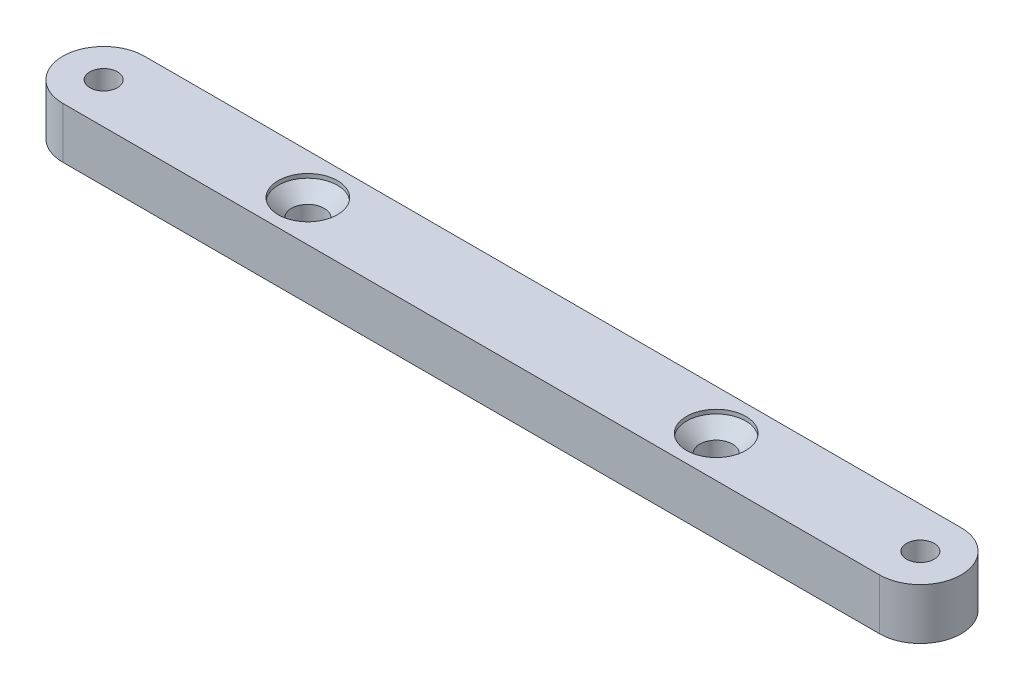
from build123d import *

# Parameters (mm, degrees)
ESQUISSE1_R        = 1.35
BOSS_EXTRU_1_DEPTH = 5


with BuildPart() as part:
    # Esquisse1 → Boss.-Extru.1 (new body)
    with BuildSketch(Plane(origin=(0, 0, 0), x_dir=(1, 0, 0), z_dir=(0, 1, 0))):
        with BuildLine():
            Line((40, -4), (-40, -4))
            ThreePointArc((-40, -4), (-44, 0), (-40, 4))
            Line((-40, 4), (40, 4))
            ThreePointArc((40, 4), (44, 0), (40, -4))
        make_face()
        with Locations(Location((-40, 0, 0), (0, 0, 270))):
            Circle(ESQUISSE1_R, mode=Mode.SUBTRACT)
        with Locations(Location((40, 0, 0), (0, 0, 90))):
            Circle(ESQUISSE1_R, mode=Mode.SUBTRACT)
    extrude(amount=BOSS_EXTRU_1_DEPTH)

    # Esquisse2 → Fraisage pour vis à tête fraisée M31 (revolve, cut)
    with BuildSketch(Plane(origin=(-20, 5, 0), x_dir=(0, 0, 1), z_dir=(1, 0, 0))):
        Polygon((0, 0), (0, 5), (1.6, 5), (1.6, 1.7), (2.9, 0.4), (2.9, 0), align=None)
    fraisage_pour_vis_t_te_frais_e_m31 = revolve(axis=Axis((-20, 11.35, 0), (0, -1, 0)), mode=Mode.SUBTRACT)

    # Symétrie1: Fraisage pour vis à tête fraisée M31 across plane
    add(fraisage_pour_vis_t_te_frais_e_m31.mirror(Plane(origin=(0, 0, 0), x_dir=(0, 0, 1), z_dir=(1, 0, 0))), mode=Mode.SUBTRACT)


solid = part.part
